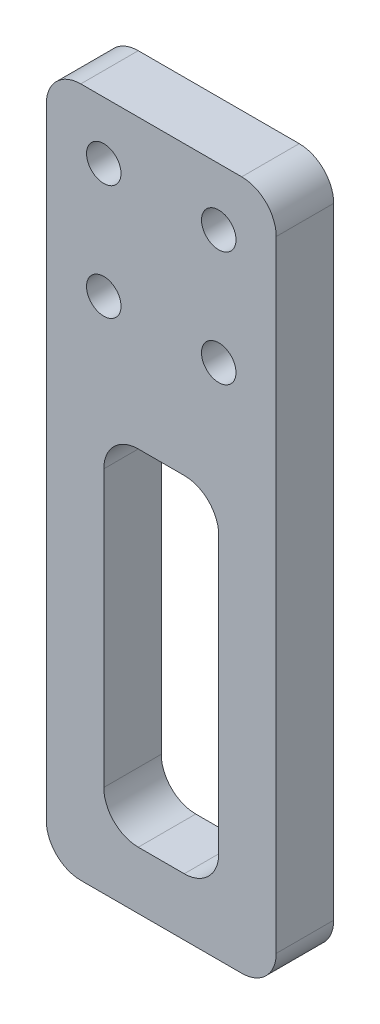
from build123d import *

# Parameters (mm, degrees)
SKETCH_1_W          = 20
SKETCH_1_H          = 60
EXTRUDE_1_DEPTH     = 5
SKETCH_2_R          = 1.5
CUT_EXTRUDE_1_DEPTH = 33.015621187
SKETCH_3_W          = 10
SKETCH_3_H          = 30
CUT_EXTRUDE_2_DEPTH = 33.015621187
FILLET_1_R          = 3


with BuildPart() as part:
    # 草图1 → 凸台-拉伸1 (new body)
    with BuildSketch(Plane.XY):
        Rectangle(SKETCH_1_W, SKETCH_1_H)
    extrude(amount=EXTRUDE_1_DEPTH)

    # 草图2 → 切除-拉伸1 (cut, through all)
    with BuildSketch(Plane.XY.offset(5)):
        with Locations((-5, 25)):
            Circle(SKETCH_2_R)
        with Locations((-5, 15)):
            Circle(SKETCH_2_R)
        with Locations(Location((5, 15, 0), (0, 0, 180))):
            Circle(SKETCH_2_R)
        with Locations(Location((5, 25, 0), (0, 0, 180))):
            Circle(SKETCH_2_R)
    extrude(amount=-CUT_EXTRUDE_1_DEPTH, mode=Mode.SUBTRACT)

    # 草图3 → 切除-拉伸2 (cut, through all)
    with BuildSketch(Plane.XY.offset(5)):
        with Locations((0, -10)):
            Rectangle(SKETCH_3_W, SKETCH_3_H)
    extrude(amount=-CUT_EXTRUDE_2_DEPTH, mode=Mode.SUBTRACT)

    # 圆角1
    fillet_1_edges = [part.edges().sort_by_distance(p)[0] for p in [
        (5, 5, 2.5),
        (5, -25, 2.5),
        (-5, -25, 2.5),
        (-5, 5, 2.5),
        (10, -30, 2.5),
        (-10, -30, 2.5),
        (-10, 30, 2.5),
        (10, 30, 2.5),
    ]]
    fillet(fillet_1_edges, radius=FILLET_1_R)


solid = part.part
